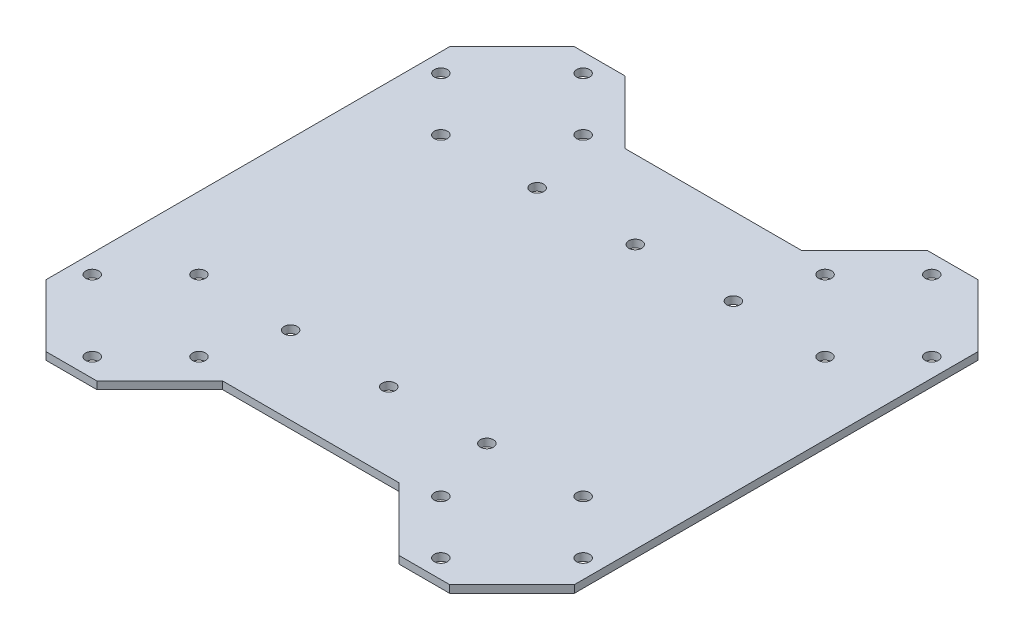
from build123d import *

# Parameters (mm, degrees)
BOSS_EXTRUDE1_DEPTH = 3
BOSS_EXTRUDE2_DEPTH = 2
SKETCH6_R           = 2.6
CUT_EXTRUDE6_DEPTH  = 167.076115532
SKETCH3_R           = 2.6
CUT_EXTRUDE7_DEPTH  = 167.076115532
CUT_EXTRUDE8_DEPTH  = 167.076115532


with BuildPart() as part:
    # Sketch1 → Boss-Extrude1 (new body)
    with BuildSketch(Plane(origin=(0, 0, 0), x_dir=(1, 0, 0), z_dir=(0, 1, 0))):
        Polygon((-59.316686906, 108.225499677), (101.185838411, 108.225499677), (125.934575753, 83.476762335), (125.934575753, -77.025762982), (101.185838411, -101.774500323), (-59.316686906, -101.774500323), (-84.065424247, -77.025762982), (-84.065424247, 83.476762335), align=None)
    extrude(amount=BOSS_EXTRUDE1_DEPTH)

    # Sketch2 → Boss-Extrude2 (add)
    with BuildSketch(Plane(origin=(0, 3, 0), x_dir=(1, 0, 0), z_dir=(0, 1, 0))):
        Polygon((-84.065424247, -77.025762982), (-45.174551282, -38.134890016), (-20.425813941, -62.883627358), (-59.316686906, -101.774500323), align=None)
        Polygon((125.934575753, -77.025762982), (93.880849872, -37.104770943), (66.751068905, -58.888061335), (101.185838411, -101.774500323), align=None)
        Polygon((101.185838411, 108.225499677), (62.16108336, 69.955487183), (86.665825958, 44.96747398), (125.934575753, 83.476762335), align=None)
        Polygon((-59.316686906, 108.225499677), (-24.100270952, 65.978558399), (-50.874640527, 43.659845911), (-84.065424247, 83.476762335), align=None)
    extrude(amount=-BOSS_EXTRUDE2_DEPTH)

    # Sketch6 → Cut-Extrude6 (cut, through all)
    with BuildSketch(Plane(origin=(0, 3, 0), x_dir=(1, 0, 0), z_dir=(0, 1, 0))):
        with Locations((-18.065424247, -45.774500323)):
            Circle(SKETCH6_R)
        with Locations((20.934575753, -45.774500323)):
            Circle(SKETCH6_R)
        with Locations((-18.065424247, 52.225499677)):
            Circle(SKETCH6_R)
        with Locations((59.934575753, -45.774500323)):
            Circle(SKETCH6_R)
        with Locations((20.934575753, 52.225499677)):
            Circle(SKETCH6_R)
        with Locations((59.934575753, 52.225499677)):
            Circle(SKETCH6_R)
    extrude(amount=-CUT_EXTRUDE6_DEPTH, mode=Mode.SUBTRACT)

    # Sketch3 → Cut-Extrude7 (cut, through all)
    with BuildSketch(Plane(origin=(0, 3, 0), x_dir=(1, 0, 0), z_dir=(0, 1, 0))):
        with Locations((-27.143328362, 79.587675039)):
            Circle(SKETCH3_R)
        with Locations((-55.427599609, 51.303403791)):
            Circle(SKETCH3_R)
        with Locations((-76.640803045, 72.516607227)):
            Circle(SKETCH3_R)
        with Locations((-48.356531798, 100.800878474)):
            Circle(SKETCH3_R)
        with Locations((118.50995455, 72.516607227)):
            Circle(SKETCH3_R)
        with Locations((97.296751114, 51.303403791)):
            Circle(SKETCH3_R)
        with Locations((69.012479867, 79.587675039)):
            Circle(SKETCH3_R)
        with Locations((90.225683303, 100.800878474)):
            Circle(SKETCH3_R)
        with Locations((-55.427599609, -44.852404438)):
            Circle(SKETCH3_R)
        with Locations((-76.640803045, -66.065607873)):
            Circle(SKETCH3_R)
        with Locations((-48.356531798, -94.349879121)):
            Circle(SKETCH3_R)
        with Locations((-27.143328362, -73.136675685)):
            Circle(SKETCH3_R)
        with Locations((118.50995455, -66.065607873)):
            Circle(SKETCH3_R)
        with Locations((97.296751114, -44.852404438)):
            Circle(SKETCH3_R)
        with Locations((90.225683303, -94.349879121)):
            Circle(SKETCH3_R)
        with Locations((69.012479867, -73.136675685)):
            Circle(SKETCH3_R)
    extrude(amount=-CUT_EXTRUDE7_DEPTH, mode=Mode.SUBTRACT)

    # Sketch7 → Cut-Extrude8 (cut, through all)
    with BuildSketch(Plane(origin=(0, 3, 0), x_dir=(1, 0, 0), z_dir=(0, 1, 0))):
        Polygon((-14.065424247, 83.225499677), (55.934575753, 83.225499677), (80.934575753, 108.225499677), (-39.065424247, 108.225499677), align=None)
        Polygon((-14.065424247, -76.774500323), (-39.065424247, -101.774500323), (80.934575753, -101.774500323), (55.934575753, -76.774500323), align=None)
    extrude(amount=-CUT_EXTRUDE8_DEPTH, mode=Mode.SUBTRACT)


solid = part.part
